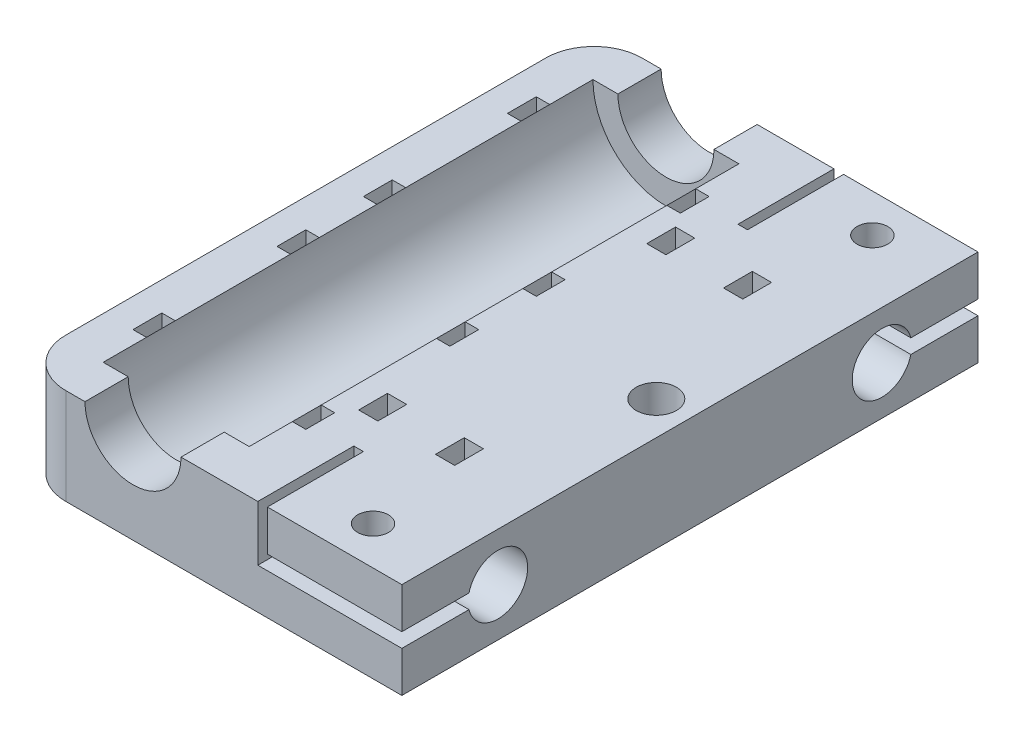
from build123d import *

# Parameters (mm, degrees)
SKETCH_2_W           = 40000
SKETCH_2_H           = 60000
EXTRUDE_1_DEPTH      = 10000
SKETCH_4_R           = 7600
CUT_EXTRUDE_2_DEPTH  = 25500
SKETCH_5_R           = 5000
CUT_EXTRUDE_3_DEPTH  = 40000
SKETCH_6_W           = 2000
SKETCH_6_H           = 3000
CUT_EXTRUDE_4_DEPTH  = 80000
SKETCH_13_R          = 3100
CUT_EXTRUDE_6_DEPTH  = 18000
SKETCH_16_W          = 10031.479605139
SKETCH_16_H          = 1500
CUT_EXTRUDE_7_DEPTH  = 15000
CUT_EXTRUDE_8_REACH  = 37418.574
SKETCH_17_W          = 1000
SKETCH_17_H          = 10000
SKETCH_18_R          = 1600
CUT_EXTRUDE_9_DEPTH  = 15000
SKETCH_19_W          = 1400
SKETCH_19_H          = 3000
CUT_EXTRUDE_10_DEPTH = 15000
FILLET_1_R           = 5000
SKETCH_20_R          = 2100
CUT_EXTRUDE_11_DEPTH = 10000
SKETCH_21_W          = 6000
SKETCH_21_H          = 3000
CUT_EXTRUDE_12_DEPTH = 2000
FILLET_2_R           = 1000


with BuildPart() as part:
    # 草圖2 → 填料-伸長1 (new body)
    with BuildSketch(Plane(origin=(0, 0, 0), x_dir=(1, 0, 0), z_dir=(0, 1, 0))):
        Rectangle(SKETCH_2_W, SKETCH_2_H)
    extrude(amount=EXTRUDE_1_DEPTH)

    # 草圖4 → 除料-伸長2 (cut, symmetric)
    with BuildSketch(Plane.XY):
        with Locations((-8000, 10000)):
            Circle(SKETCH_4_R)
    extrude(amount=CUT_EXTRUDE_2_DEPTH, both=True, mode=Mode.SUBTRACT)

    # 草圖5 → 除料-伸長3 (cut, symmetric)
    with BuildSketch(Plane.XY):
        with Locations((-8000, 10000)):
            Circle(SKETCH_5_R)
    extrude(amount=CUT_EXTRUDE_3_DEPTH, both=True, mode=Mode.SUBTRACT)

    # 草圖6 → 除料-伸長4 (cut)
    with BuildSketch(Plane(origin=(0, 10000, 0), x_dir=(1, 0, 0), z_dir=(0, 1, 0))):
        with Locations((11000, -15000)):
            Rectangle(SKETCH_6_W, SKETCH_6_H)
        with Locations((3000, 15000)):
            Rectangle(SKETCH_6_W, SKETCH_6_H)
        with Locations((11000, 15000)):
            Rectangle(SKETCH_6_W, SKETCH_6_H)
        with Locations((3000, -15000)):
            Rectangle(SKETCH_6_W, SKETCH_6_H)
    extrude(amount=-CUT_EXTRUDE_4_DEPTH, mode=Mode.SUBTRACT)

    # 草圖13 → 除料-伸長6 (cut)
    with BuildSketch(Plane(origin=(20000, 0, 0), x_dir=(0, 0, -1), z_dir=(1, 0, 0))):
        with Locations((-20000, 5000)):
            Circle(SKETCH_13_R)
        with Locations(Location((20000, 5000, 0), (0, 0, 180))):
            Circle(SKETCH_13_R)
    extrude(amount=-CUT_EXTRUDE_6_DEPTH, mode=Mode.SUBTRACT)

    # 草圖16 → 除料-伸長7 (cut)
    with BuildSketch(Plane(origin=(20000, 0, 0), x_dir=(0, 0, -1), z_dir=(1, 0, 0))):
        with Locations((-26040.217814772, 5000)):
            Rectangle(SKETCH_16_W, SKETCH_16_H)
        with Locations((26040.217814772, 5000)):
            Rectangle(SKETCH_16_W, SKETCH_16_H)
    extrude(amount=-CUT_EXTRUDE_7_DEPTH, mode=Mode.SUBTRACT)

    # 除料-伸長8: up to this face of the body (flat: up to its plane)
    cut_extrude_8_end = Plane(part.part.faces().sort_by_distance((12500, 4250, -26503.95312427))[0])
    # 草圖17 → 除料-伸長8 (cut, up to the picked face)
    with BuildSketch(Plane(origin=(0, 10000, 0), x_dir=(1, 0, 0), z_dir=(0, 1, 0)), mode=Mode.PRIVATE) as cut_extrude_8_sk1:
        with Locations((5500, 25000)):
            Rectangle(SKETCH_17_W, SKETCH_17_H)
    cut_extrude_8_tool1 = split(extrude(cut_extrude_8_sk1.sketch, amount=-CUT_EXTRUDE_8_REACH, mode=Mode.PRIVATE), bisect_by=cut_extrude_8_end, keep=Keep.BOTH, mode=Mode.PRIVATE)
    # 草圖17 → 除料-伸長8 (cut, up to the picked face)
    with BuildSketch(Plane(origin=(0, 10000, 0), x_dir=(1, 0, 0), z_dir=(0, 1, 0)), mode=Mode.PRIVATE) as cut_extrude_8_sk2:
        with Locations((5500, -25000)):
            Rectangle(SKETCH_17_W, SKETCH_17_H)
    cut_extrude_8_tool2 = split(extrude(cut_extrude_8_sk2.sketch, amount=-CUT_EXTRUDE_8_REACH, mode=Mode.PRIVATE), bisect_by=cut_extrude_8_end, keep=Keep.BOTH, mode=Mode.PRIVATE)
    add(cut_extrude_8_tool1.solids().sort_by(Axis((5500, 10000, -25000), (0, -1, 0)))[0], mode=Mode.SUBTRACT)
    add(cut_extrude_8_tool2.solids().sort_by(Axis((5500, 10000, 25000), (0, -1, 0)))[0], mode=Mode.SUBTRACT)

    # 草圖18 → 除料-伸長9 (cut)
    with BuildSketch(Plane(origin=(0, 10000, 0), x_dir=(1, 0, 0), z_dir=(0, 1, 0))):
        with Locations(Location((13000, 26000, 0), (0, 0, 270))):
            Circle(SKETCH_18_R)
        with Locations(Location((13000, -26000, 0), (0, 0, 270))):
            Circle(SKETCH_18_R)
    extrude(amount=-CUT_EXTRUDE_9_DEPTH, mode=Mode.SUBTRACT)

    # 草圖19 → 除料-伸長10 (cut)
    with BuildSketch(Plane(origin=(0, 10000, 0), x_dir=(1, 0, 0), z_dir=(0, 1, 0))):
        with Locations((-16300, 19500)):
            Rectangle(SKETCH_19_W, SKETCH_19_H)
        with Locations((-16300, 4500)):
            Rectangle(SKETCH_19_W, SKETCH_19_H)
        with Locations((-16300, -4500)):
            Rectangle(SKETCH_19_W, SKETCH_19_H)
        with Locations((-16300, -19500)):
            Rectangle(SKETCH_19_W, SKETCH_19_H)
        with Locations((300, -19500)):
            Rectangle(SKETCH_19_W, SKETCH_19_H)
        with Locations((300, -4500)):
            Rectangle(SKETCH_19_W, SKETCH_19_H)
        with Locations((300, 4500)):
            Rectangle(SKETCH_19_W, SKETCH_19_H)
        with Locations((300, 19500)):
            Rectangle(SKETCH_19_W, SKETCH_19_H)
    extrude(amount=-CUT_EXTRUDE_10_DEPTH, mode=Mode.SUBTRACT)

    # 圓角1
    fillet_1_edges = [part.edges().sort_by_distance(p)[0] for p in [
        (-20000, 5000, 30000),
        (-20000, 5000, -30000),
    ]]
    fillet(fillet_1_edges, radius=FILLET_1_R)

    # 草圖20 → 除料-伸長11 (cut)
    with BuildSketch(Plane(origin=(0, 10000, 0), x_dir=(1, 0, 0), z_dir=(0, 1, 0))):
        with Locations(Location((16500, 0, 0), (0, 0, 270))):
            Circle(SKETCH_20_R)
    extrude(amount=-CUT_EXTRUDE_11_DEPTH, mode=Mode.SUBTRACT)

    # 草圖21 → 除料-伸長12 (cut)
    with BuildSketch(Plane.XZ):
        with Locations((7000, 15000)):
            Rectangle(SKETCH_21_W, SKETCH_21_H)
        with Locations((7000, -15000)):
            Rectangle(SKETCH_21_W, SKETCH_21_H)
    extrude(amount=-CUT_EXTRUDE_12_DEPTH, mode=Mode.SUBTRACT)

    # 圓角2
    fillet_2_edges = [part.edges().sort_by_distance(p)[0] for p in [
        (4000, 2000, 15000),
        (10000, 2000, 15000),
        (4000, 2000, -15000),
        (10000, 2000, -15000),
    ]]
    fillet(fillet_2_edges, radius=FILLET_2_R)


solid = part.part
